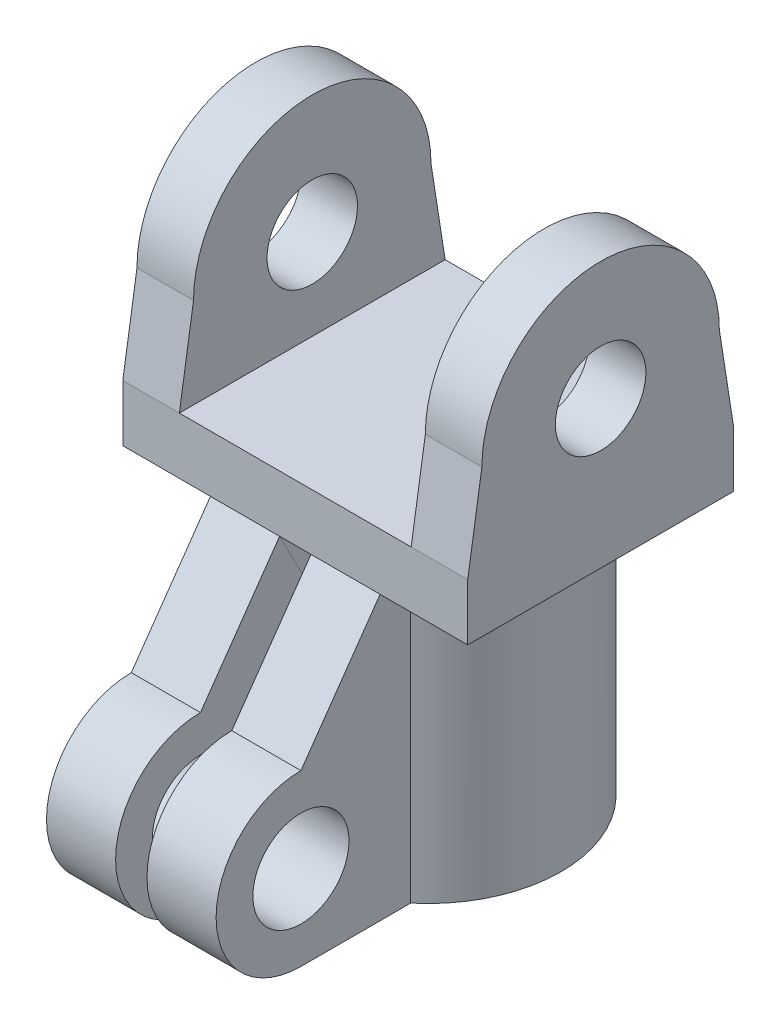
from build123d import *

# Parameters (mm, degrees)
SKETCH_1_R           = 4.7
SKETCH_1_R_2         = 2.7
EXTRUDE_1_DEPTH      = 10
SKETCH_2_W           = 12.2
SKETCH_2_H           = 9.4
EXTRUDE_2_DEPTH      = 2
SKETCH_3_R           = 1.6
EXTRUDE_3_DEPTH      = 2
EXTRUDE_4_DEPTH      = 3
EXTRUDE_4_DEPTH_BACK = 3
SKETCH_4_R           = 1.7
SKETCH_5_R           = 2.7
CUT_EXTRUDE_1_DEPTH  = 6
SKETCH_6_W           = 1.109396916
SKETCH_6_H           = 10
CUT_EXTRUDE_2_DEPTH  = 23.887114279


with BuildPart() as part:
    # 草图1 → 凸台-拉伸1 (new body)
    with BuildSketch(Plane(origin=(0, 0, 0), x_dir=(1, 0, 0), z_dir=(0, 1, 0))):
        with Locations(Location((0, 0, 0), (0, 0, 270))):
            Circle(SKETCH_1_R)
        with Locations(Location((0, 0, 0), (0, 0, 270))):
            Circle(SKETCH_1_R_2, mode=Mode.SUBTRACT)
    extrude(amount=EXTRUDE_1_DEPTH)

    # 草图2 → 凸台-拉伸2 (add)
    with BuildSketch(Plane(origin=(0, 10, 0), x_dir=(1, 0, 0), z_dir=(0, 1, 0))):
        Rectangle(SKETCH_2_W, SKETCH_2_H)
    extrude_2 = extrude(amount=EXTRUDE_2_DEPTH)

    # 草图3 → 凸台-拉伸3 (add)
    with BuildSketch(Plane.ZY.offset(6.1)):
        with BuildLine():
            Line((-4.7, 12), (4.7, 12))
            Line((4.7, 12), (4.2, 15.2))
            ThreePointArc((4.2, 15.2), (0, 19.4), (-4.2, 15.2))
            Line((-4.2, 15.2), (-4.7, 12))
        make_face()
        with Locations((0, 15.2)):
            Circle(SKETCH_3_R, mode=Mode.SUBTRACT)
    extrude_3 = extrude(amount=-EXTRUDE_3_DEPTH)

    # 镜向1: 凸台-拉伸2, 凸台-拉伸3 across plane
    add(extrude_2.mirror(Plane(origin=(0, 0, 0), x_dir=(0, 0, 1), z_dir=(1, 0, 0))))
    add(extrude_3.mirror(Plane(origin=(0, 0, 0), x_dir=(0, 0, 1), z_dir=(1, 0, 0))))


with BuildPart() as body_2:
    # 草图4 → 凸台-拉伸4 (new, two sides: drawn at the far end of the back side and taken through both)
    with BuildSketch(Plane(origin=(0, 0, 0), x_dir=(0, 0, -1), z_dir=(1, 0, 0)).offset(-EXTRUDE_4_DEPTH_BACK)):
        with BuildLine():
            Line((-4.7, 10), (0, 10))
            Line((0, 10), (0, 0))
            Line((0, 0), (-7.5, 0))
            ThreePointArc((-7.5, 0), (-10.5, 3), (-7.5, 6))
            Line((-7.5, 6), (-4.7, 10))
        make_face()
        with Locations((-7.5, 3)):
            Circle(SKETCH_4_R, mode=Mode.SUBTRACT)
    extrude(amount=EXTRUDE_4_DEPTH + EXTRUDE_4_DEPTH_BACK)

    # 草图5 → 切除-拉伸1 (cut)
    with BuildSketch(Plane.XZ):
        with Locations(Location((0, 0, 0), (0, 0, 90))):
            Circle(SKETCH_5_R)
    extrude(amount=-CUT_EXTRUDE_1_DEPTH, mode=Mode.SUBTRACT)


with BuildPart() as cut_extrude_2_tool:
    # 草图6 → 切除-拉伸2 (new, through all)
    with BuildSketch(Plane.XY):
        with Locations((0, 5)):
            Rectangle(SKETCH_6_W, SKETCH_6_H)
    extrude(amount=CUT_EXTRUDE_2_DEPTH)


with BuildPart() as part_1:
    add(part.part)

    # 切除-拉伸2: cut by cut_extrude_2_tool
    add(cut_extrude_2_tool.part, mode=Mode.SUBTRACT)


with BuildPart() as body_2_1:
    add(body_2.part)

    # 切除-拉伸2: cut by cut_extrude_2_tool
    add(cut_extrude_2_tool.part, mode=Mode.SUBTRACT)


solid = Compound([part_1.part, body_2_1.part])
